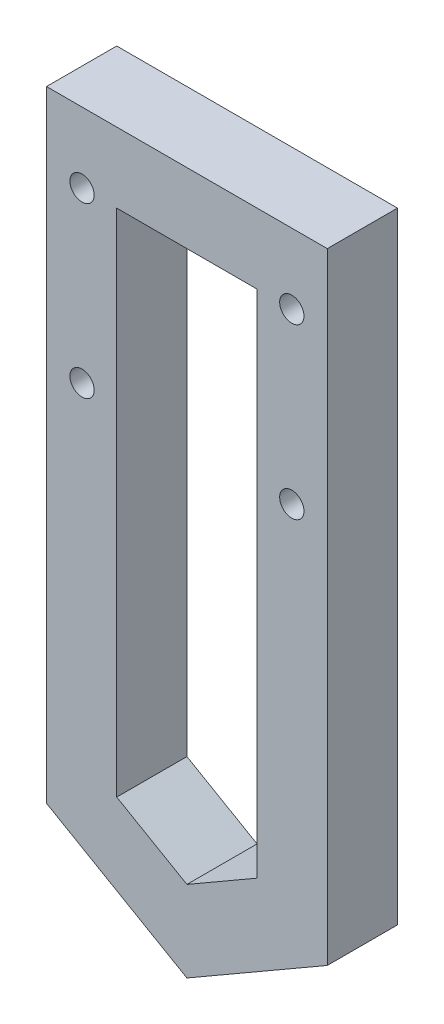
from build123d import *

# Parameters (mm, degrees)
BOSS_EXTRUDE1_DEPTH = 10
SKETCH3_R           = 1.73
CUT_EXTRUDE1_DEPTH  = 10


with BuildPart() as part:
    # Sketch1 → Boss-Extrude1 (new body)
    with BuildSketch(Plane.XY):
        Polygon((-12.797368251, 238.318722846), (-32.797368251, 238.318722846), (-32.797368251, 228.318722846), (-22.797368251, 228.318722846), (-22.797368251, 155.639230922), (-22.797368251, 144.092225538), (-12.797368251, 149.86572823), align=None)
        Polygon((-32.797368251, 228.318722846), (-32.797368251, 238.318722846), (-52.797368251, 238.318722846), (-52.797368251, 149.86572823), (-42.797368251, 144.092225538), (-42.797368251, 155.639230922), (-42.797368251, 228.318722846), align=None)
        Polygon((-32.797368251, 138.318722846), (-32.797368251, 149.86572823), (-37.797368251, 152.752479576), (-42.797368251, 155.639230922), (-42.797368251, 144.092225538), align=None)
        Polygon((-27.797368251, 152.752479576), (-32.797368251, 149.86572823), (-32.797368251, 138.318722846), (-22.797368251, 144.092225538), (-22.797368251, 155.639230922), align=None)
    extrude(amount=BOSS_EXTRUDE1_DEPTH)

    # Sketch3 → Cut-Extrude1 (cut)
    with BuildSketch(Plane.XY.offset(10)):
        with Locations((-47.742368251, 228.318722846)):
            Circle(SKETCH3_R)
        with Locations((-47.742368251, 204.258722846)):
            Circle(SKETCH3_R)
        with Locations((-17.852368251, 204.258722846)):
            Circle(SKETCH3_R)
        with Locations((-17.852368251, 228.318722846)):
            Circle(SKETCH3_R)
    extrude(amount=-CUT_EXTRUDE1_DEPTH, mode=Mode.SUBTRACT)


solid = part.part
